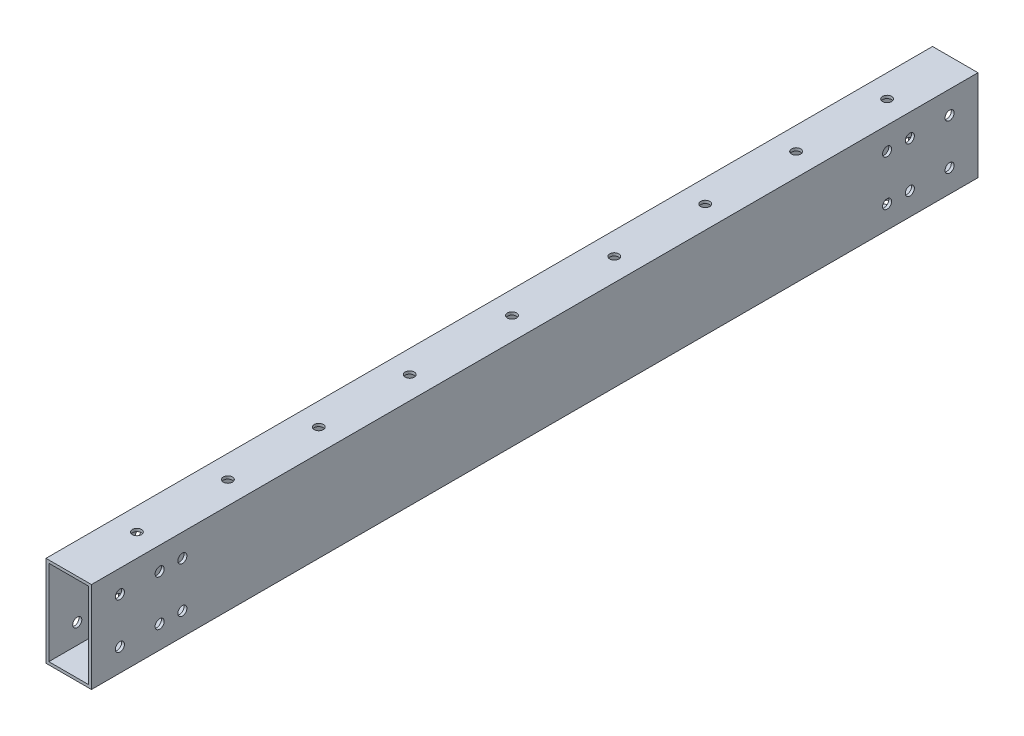
from build123d import *

# Parameters (mm, degrees)
SKETCH1_W           = 25.4
SKETCH1_H           = 50.8
SKETCH1_W_2         = 22.225
SKETCH1_H_2         = 47.625
BOSS_EXTRUDE1_DEPTH = 495.3
SKETCH2_R           = 2.54
CUT_EXTRUDE1_DEPTH  = 497.600855819
SKETCH3_R           = 2.54
CUT_EXTRUDE2_DEPTH  = 499.060257399


with BuildPart() as part:
    # Sketch1 → Boss-Extrude1 (new body)
    with BuildSketch(Plane.XY):
        Rectangle(SKETCH1_W, SKETCH1_H)
        Rectangle(SKETCH1_W_2, SKETCH1_H_2, mode=Mode.SUBTRACT)
    extrude(amount=BOSS_EXTRUDE1_DEPTH)

    # Sketch2 → Cut-Extrude1 (cut, through all)
    with BuildSketch(Plane(origin=(12.7, 0, 0), x_dir=(0, 0, -1), z_dir=(1, 0, 0))):
        with Locations((-479.425, -12.7)):
            Circle(SKETCH2_R)
        with Locations((-457.2, -12.7)):
            Circle(SKETCH2_R)
        with Locations((-479.425, 12.7)):
            Circle(SKETCH2_R)
        with Locations((-457.2, 12.7)):
            Circle(SKETCH2_R)
        with Locations(Location((-38.1, 12.7, 0), (0, 0, 180))):
            Circle(SKETCH2_R)
        with Locations(Location((-15.875, 12.7, 0), (0, 0, 180))):
            Circle(SKETCH2_R)
        with Locations(Location((-38.1, -12.7, 0), (0, 0, 180))):
            Circle(SKETCH2_R)
        with Locations(Location((-15.875, -12.7, 0), (0, 0, 180))):
            Circle(SKETCH2_R)
        with Locations((-444.5, 12.7)):
            Circle(SKETCH2_R)
        with Locations((-444.5, -12.7)):
            Circle(SKETCH2_R)
        with Locations(Location((-50.8, -12.7, 0), (0, 0, 180))):
            Circle(SKETCH2_R)
        with Locations(Location((-50.8, 12.7, 0), (0, 0, 180))):
            Circle(SKETCH2_R)
    extrude(amount=-CUT_EXTRUDE1_DEPTH, mode=Mode.SUBTRACT)

    # Sketch3 → Cut-Extrude2 (cut, through all)
    with BuildSketch(Plane(origin=(0, 25.4, 0), x_dir=(1, 0, 0), z_dir=(0, 1, 0))):
        with Locations(Location((0, -457.2, 0), (0, 0, 270))):
            Circle(SKETCH3_R)
        with Locations(Location((0, -406.4, 0), (0, 0, 270))):
            Circle(SKETCH3_R)
        with Locations(Location((0, -355.6, 0), (0, 0, 270))):
            Circle(SKETCH3_R)
        with Locations(Location((0, -304.8, 0), (0, 0, 270))):
            Circle(SKETCH3_R)
        with Locations(Location((0, -190.5, 0), (0, 0, 90))):
            Circle(SKETCH3_R)
        with Locations(Location((0, -139.7, 0), (0, 0, 90))):
            Circle(SKETCH3_R)
        with Locations(Location((0, -88.9, 0), (0, 0, 90))):
            Circle(SKETCH3_R)
        with Locations(Location((0, -38.1, 0), (0, 0, 90))):
            Circle(SKETCH3_R)
        with Locations(Location((0, -247.65, 0), (0, 0, 270))):
            Circle(SKETCH3_R)
    extrude(amount=-CUT_EXTRUDE2_DEPTH, mode=Mode.SUBTRACT)


solid = part.part
